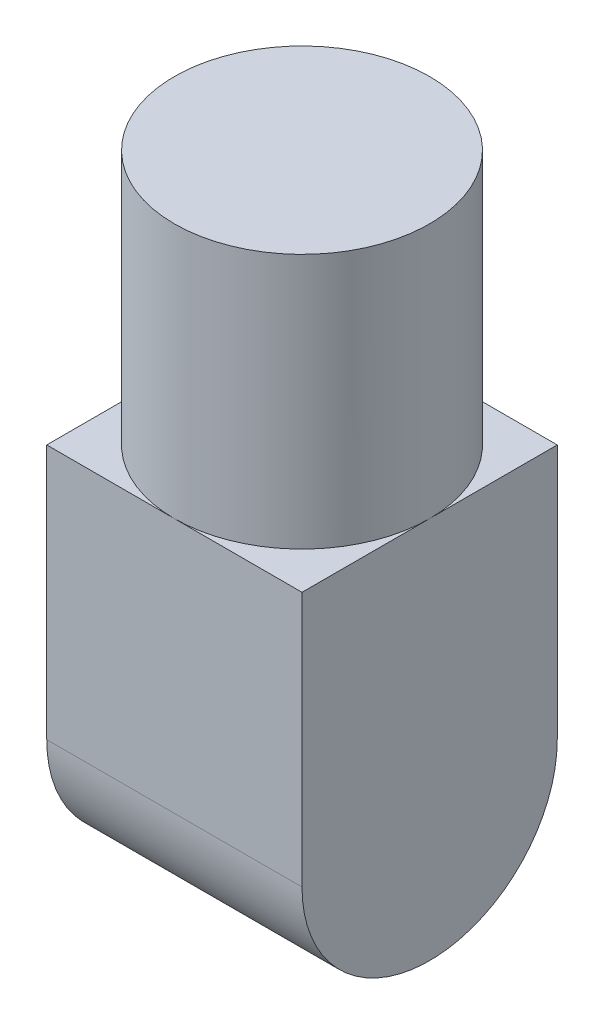
from build123d import *

# Parameters (mm, degrees)
BOSS_EXTRUDE1_DEPTH = 80
SKETCH2_R           = 40
BOSS_EXTRUDE2_DEPTH = 80


with BuildPart() as part:
    # Sketch1 → Boss-Extrude1 (new body)
    with BuildSketch(Plane(origin=(0, 0, 0), x_dir=(0, 0, -1), z_dir=(1, 0, 0))):
        with BuildLine():
            Line((-40, -40), (-40, 40))
            Line((-40, 40), (40, 40))
            Line((40, 40), (40, -40))
            ThreePointArc((40, -40), (0, -80), (-40, -40))
        make_face()
    extrude(amount=BOSS_EXTRUDE1_DEPTH)

    # Sketch2 → Boss-Extrude2 (add)
    with BuildSketch(Plane(origin=(0, 40, 0), x_dir=(1, 0, 0), z_dir=(0, 1, 0))):
        with Locations(Location((40, 0, 0), (0, 0, 270))):
            Circle(SKETCH2_R)
    extrude(amount=BOSS_EXTRUDE2_DEPTH)


solid = part.part
